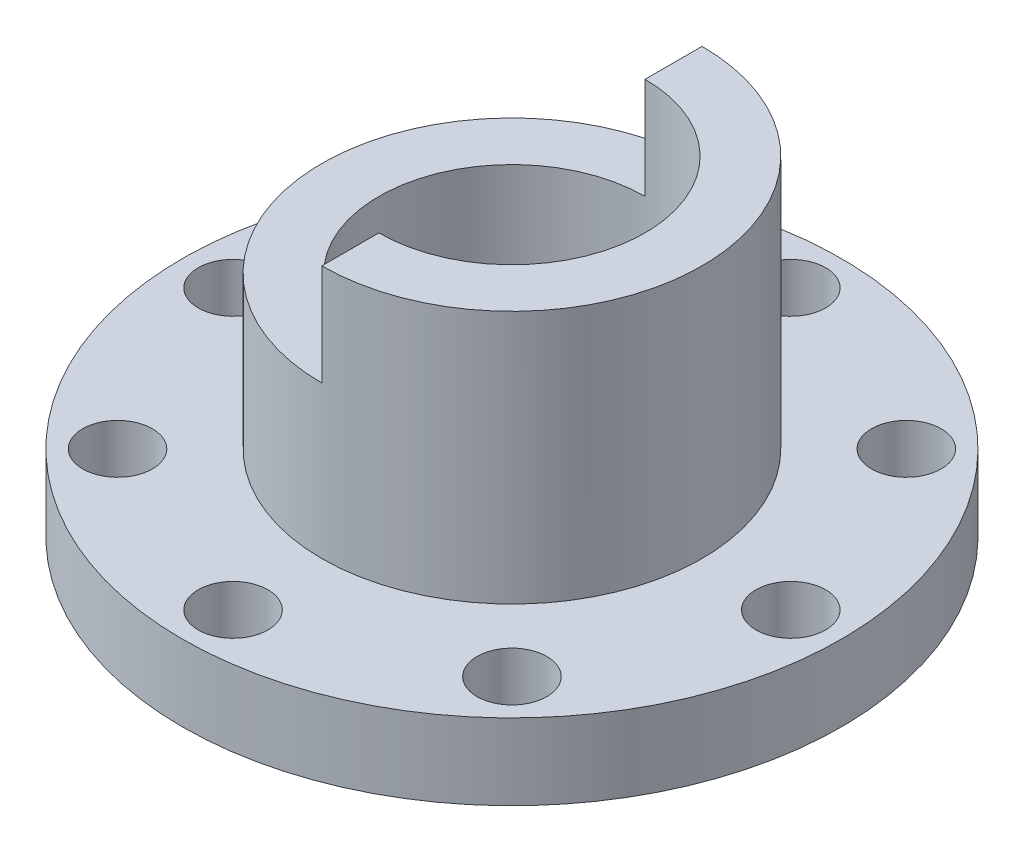
from build123d import *

# Parameters (mm, degrees)
SKETCH1_R           = 13
SKETCH1_R_2         = 1.375
SKETCH1_R_3         = 5
BOSS_EXTRUDE1_DEPTH = 3
SKETCH2_R           = 7.5
SKETCH2_R_2         = 5
BOSS_EXTRUDE2_DEPTH = 10
SKETCH3_R           = 5.25
CUT_EXTRUDE1_DEPTH  = 18
CUT_EXTRUDE2_DEPTH  = 4
CUT_EXTRUDE3_START  = -10
SKETCH5_R           = 7.5
SKETCH5_R_2         = 7.45
CUT_EXTRUDE3_DEPTH  = 10
SKETCH6_R           = 7.5
SKETCH6_R_2         = 5.25
BOSS_EXTRUDE3_DEPTH = 6
BOSS_EXTRUDE4_DEPTH = 4


with BuildPart() as part:
    # Sketch1 → Boss-Extrude1 (new body)
    with BuildSketch(Plane(origin=(0, 0, 0), x_dir=(1, 0, 0), z_dir=(0, 1, 0))):
        with Locations(Location((0, 0, 0), (0, 0, 270))):
            Circle(SKETCH1_R)
        with Locations(Location((0, 11, 0), (0, 0, 270))):
            Circle(SKETCH1_R_2, mode=Mode.SUBTRACT)
        with Locations(Location((7.778174593, 7.778174593, 0), (0, 0, 270))):
            Circle(SKETCH1_R_2, mode=Mode.SUBTRACT)
        with Locations(Location((11, 0, 0), (0, 0, 270))):
            Circle(SKETCH1_R_2, mode=Mode.SUBTRACT)
        with Locations(Location((7.778174593, -7.778174593, 0), (0, 0, 270))):
            Circle(SKETCH1_R_2, mode=Mode.SUBTRACT)
        with Locations(Location((0, -11, 0), (0, 0, 270))):
            Circle(SKETCH1_R_2, mode=Mode.SUBTRACT)
        with Locations(Location((-7.778174593, -7.778174593, 0), (0, 0, 270))):
            Circle(SKETCH1_R_2, mode=Mode.SUBTRACT)
        with Locations(Location((-11, 0, 0), (0, 0, 270))):
            Circle(SKETCH1_R_2, mode=Mode.SUBTRACT)
        with Locations(Location((-7.778174593, 7.778174593, 0), (0, 0, 270))):
            Circle(SKETCH1_R_2, mode=Mode.SUBTRACT)
        with Locations(Location((0, 0, 0), (0, 0, 270))):
            Circle(SKETCH1_R_3, mode=Mode.SUBTRACT)
    extrude(amount=BOSS_EXTRUDE1_DEPTH)

    # Sketch2 → Boss-Extrude2 (add)
    with BuildSketch(Plane(origin=(0, 3, 0), x_dir=(1, 0, 0), z_dir=(0, 1, 0))):
        with Locations(Location((0, 0, 0), (0, 0, 270))):
            Circle(SKETCH2_R)
        with Locations(Location((0, 0, 0), (0, 0, 270))):
            Circle(SKETCH2_R_2, mode=Mode.SUBTRACT)
    extrude(amount=BOSS_EXTRUDE2_DEPTH)

    # Sketch3 → Cut-Extrude1 (cut)
    with BuildSketch(Plane(origin=(0, 13, 0), x_dir=(1, 0, 0), z_dir=(0, 1, 0))):
        with Locations(Location((0, 0, 0), (0, 0, 270))):
            Circle(SKETCH3_R)
    extrude(amount=-CUT_EXTRUDE1_DEPTH, mode=Mode.SUBTRACT)

    # Sketch4 → Cut-Extrude2 (cut)
    with BuildSketch(Plane(origin=(0, 13, 0), x_dir=(1, 0, 0), z_dir=(0, 1, 0))):
        with BuildLine():
            Line((0, 5.25), (0, 7.5))
            ThreePointArc((0, 7.5), (-7.5, 0), (0, -7.5))
            Line((0, -7.5), (0, -5.25))
            ThreePointArc((0, -5.25), (-5.25, 0), (0, 5.25))
        make_face()
    extrude(amount=-CUT_EXTRUDE2_DEPTH, mode=Mode.SUBTRACT)

    # Sketch5 → Cut-Extrude3 (cut)
    with BuildSketch(Plane(origin=(0, 13, 0), x_dir=(1, 0, 0), z_dir=(0, 1, 0)).offset(CUT_EXTRUDE3_START)):
        Circle(SKETCH5_R)
        with Locations(Location((0, 0, 0), (0, 0, 270))):
            Circle(SKETCH5_R_2, mode=Mode.SUBTRACT)
    extrude(amount=CUT_EXTRUDE3_DEPTH, mode=Mode.SUBTRACT)

    # Sketch6 → Boss-Extrude3 (add)
    with BuildSketch(Plane(origin=(0, 9, 0), x_dir=(1, 0, 0), z_dir=(0, 1, 0))):
        with Locations(Location((0, 0, 0), (0, 0, 270))):
            Circle(SKETCH6_R)
        with Locations(Location((0, 0, 0), (0, 0, 270))):
            Circle(SKETCH6_R_2, mode=Mode.SUBTRACT)
    extrude(amount=-BOSS_EXTRUDE3_DEPTH)

    # Sketch7 → Boss-Extrude4 (add)
    with BuildSketch(Plane(origin=(0, 9, 0), x_dir=(1, 0, 0), z_dir=(0, 1, 0))):
        with BuildLine():
            ThreePointArc((7.5, 0), (5.303300859, 5.303300859), (0, 7.5))
            Line((0, 7.5), (0, 7.45))
            ThreePointArc((0, 7.45), (5.26794552, 5.26794552), (7.45, 0))
            ThreePointArc((7.45, 0), (5.26794552, -5.26794552), (0, -7.45))
            Line((0, -7.45), (0, -7.5))
            ThreePointArc((0, -7.5), (5.303300859, -5.303300859), (7.5, 0))
        make_face()
    extrude(amount=BOSS_EXTRUDE4_DEPTH)


solid = part.part
